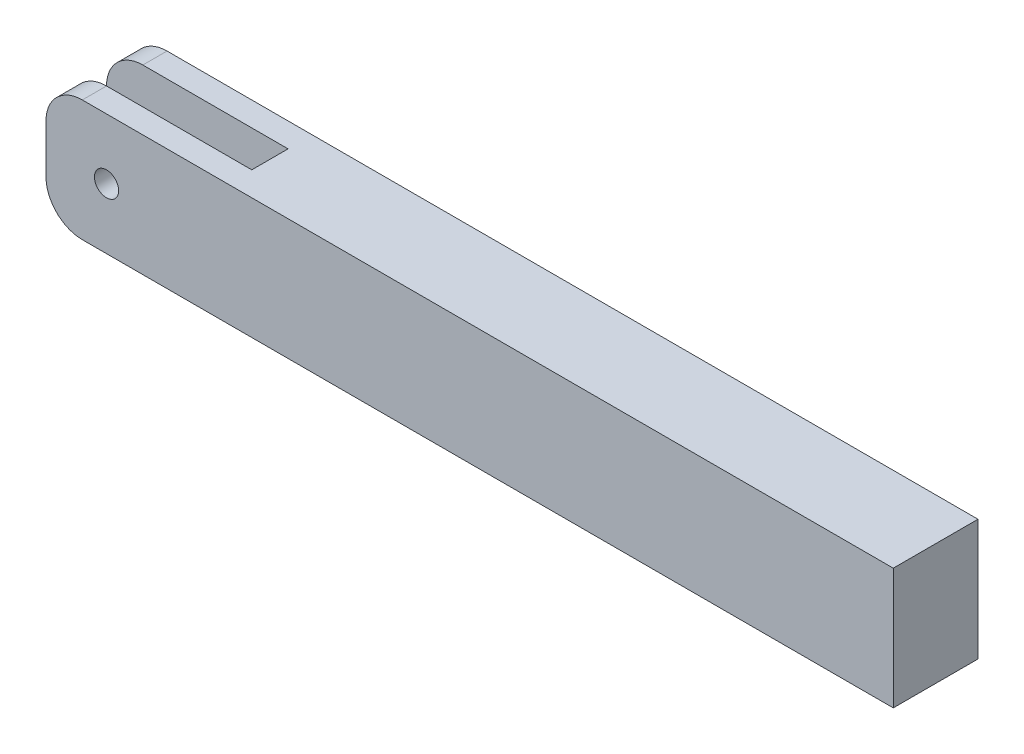
from build123d import *

# Parameters (mm, degrees)
EXTRUDE1_DEPTH          = 17.5
SKETCH2_W               = 75
SKETCH2_H               = 15
CUT_EXTRUDE1_DEPTH      = 330.289006801
CUT_EXTRUDE2_DEPTH      = 327.429548295
CUT_EXTRUDE2_DEPTH_BACK = 327.429548295
SKETCH3_R               = 5


with BuildPart() as part:
    # Sketch1 → Extrude1 (new, symmetric)
    with BuildSketch(Plane.XY):
        with BuildLine():
            Line((-10, 25), (325, 25))
            Line((325, 25), (325, -25))
            Line((325, -25), (-10, -25))
            ThreePointArc((-10, -25), (-20.606601718, -20.606601718), (-25, -10))
            Line((-25, -10), (-25, 10))
            ThreePointArc((-25, 10), (-20.606601718, 20.606601718), (-10, 25))
        make_face()
    extrude(amount=EXTRUDE1_DEPTH, both=True)

    # Sketch2 → Cut-Extrude1 (cut, through all)
    with BuildSketch(Plane(origin=(0, 25, 0), x_dir=(-1, 0, 0), z_dir=(0, 1, 0))):
        with Locations((-12.5, 0)):
            Rectangle(SKETCH2_W, SKETCH2_H)
    extrude(amount=-CUT_EXTRUDE1_DEPTH, mode=Mode.SUBTRACT)

    # Sketch3 → Cut-Extrude2 (cut, two sides: drawn at the far end of the back side and taken through both)
    with BuildSketch(Plane.XY.offset(-CUT_EXTRUDE2_DEPTH_BACK)):
        Circle(SKETCH3_R)
    extrude(amount=CUT_EXTRUDE2_DEPTH + CUT_EXTRUDE2_DEPTH_BACK, mode=Mode.SUBTRACT)


solid = part.part
